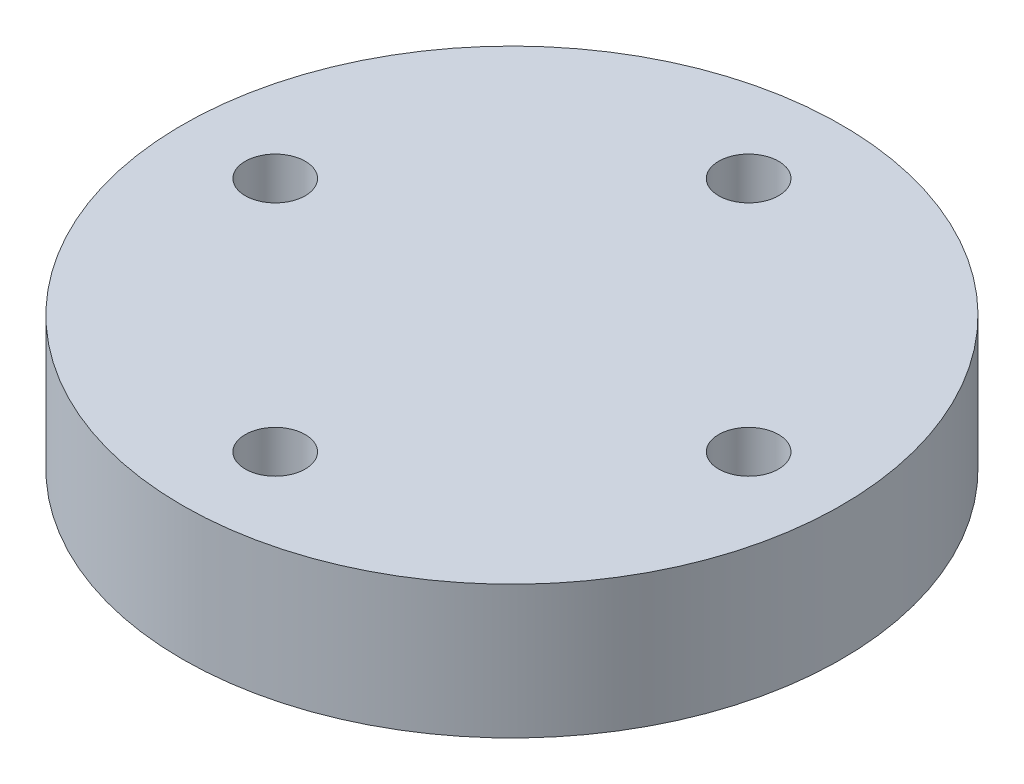
from build123d import *

# Parameters (mm, degrees)
SKETCH1_R           = 11
BOSS_EXTRUDE1_DEPTH = 4.445
SKETCH2_R           = 1
CUT_EXTRUDE1_DEPTH  = 17.178937697
CIRPATTERN1_COUNT   = 4


with BuildPart() as part:
    # Sketch1 → Boss-Extrude1 (new body)
    with BuildSketch(Plane(origin=(0, 0, 0), x_dir=(1, 0, 0), z_dir=(0, 1, 0))):
        Circle(SKETCH1_R)
    extrude(amount=BOSS_EXTRUDE1_DEPTH)

    # Sketch2 → Cut-Extrude1 (cut, through all)
    with BuildSketch(Plane(origin=(0, 4.445, 0), x_dir=(1, 0, 0), z_dir=(0, 1, 0))):
        with Locations((0, 7.9)):
            Circle(SKETCH2_R)
    cut_extrude1 = extrude(amount=-CUT_EXTRUDE1_DEPTH, mode=Mode.SUBTRACT)

    # CirPattern1: Cut-Extrude1 ×4 about axis
    cirpattern1_axis = Axis((0, 4.445, 0), (0, -1, 0))
    for i in range(1, CIRPATTERN1_COUNT):
        add(cut_extrude1.rotate(cirpattern1_axis, i * 360 / CIRPATTERN1_COUNT), mode=Mode.SUBTRACT)


solid = part.part
